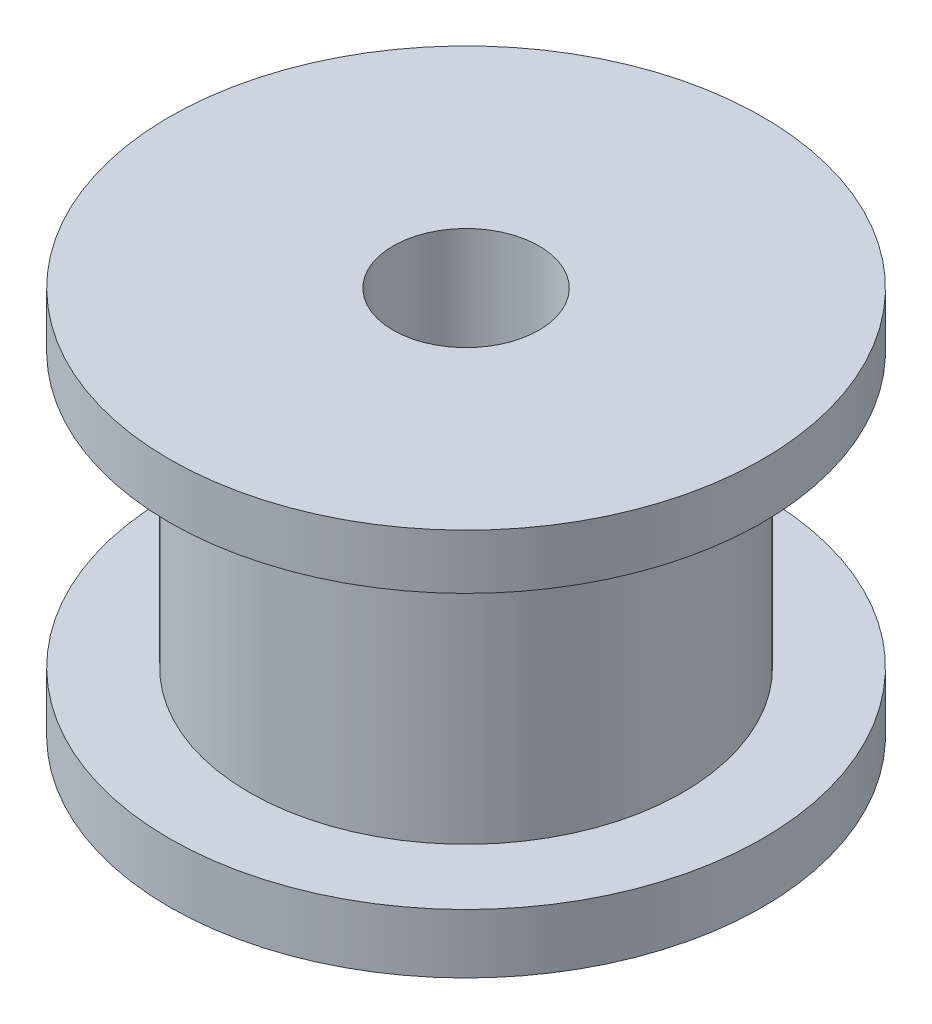
from build123d import *

# Parameters (mm, degrees)
SKETCH_2_R          = 1.6
CUT_EXTRUDE_1_DEPTH = 10


with BuildPart() as part:
    # 草图1 → 旋转1 (revolve)
    with BuildSketch(Plane.XY, mode=Mode.PRIVATE) as revolve_1_sk:
        Polygon((0, 0), (-6.5, 0), (-6.5, 1.3), (-4.75, 1.3), (-4.75, 7.3), (-6.5, 7.3), (-6.5, 8.5), (0, 8.5), align=None)
    revolve(revolve_1_sk.sketch.rotate(Axis((0, 8.5, 0), (0, -1, 0)), 270), axis=Axis((0, 8.5, 0), (0, -1, 0)))

    # 草图2 → 切除-拉伸1 (cut)
    with BuildSketch(Plane(origin=(0, 8.5, 0), x_dir=(1, 0, 0), z_dir=(0, 1, 0))):
        with Locations(Location((0, 0, 0), (0, 0, 270))):
            Circle(SKETCH_2_R)
    extrude(amount=-CUT_EXTRUDE_1_DEPTH, mode=Mode.SUBTRACT)


solid = part.part
